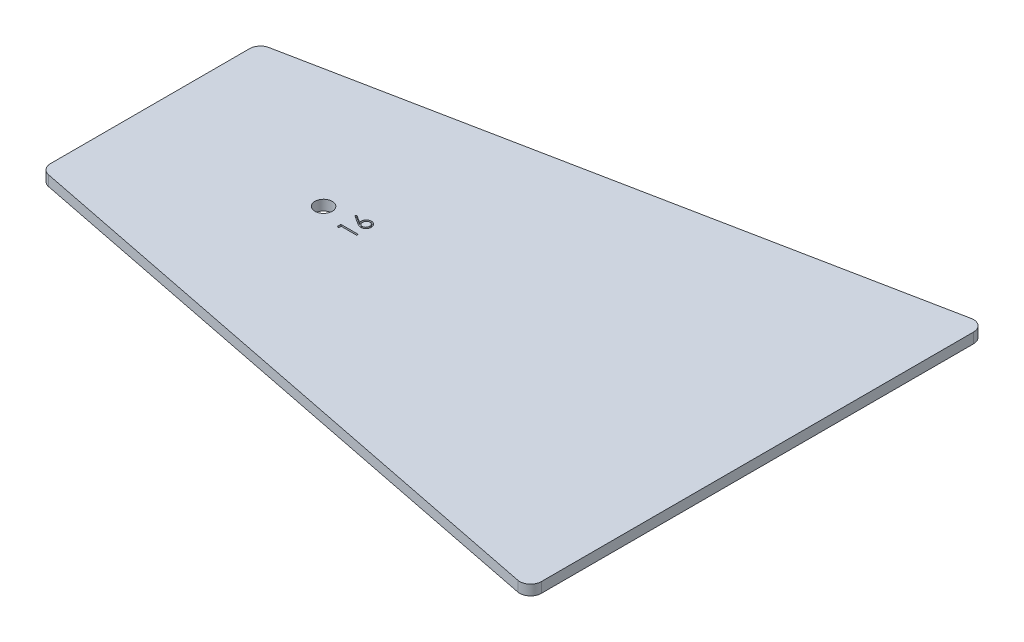
from build123d import *

# Parameters (mm, degrees)
BOSS_EXTRUDE1_DEPTH   = 5.9944
SKETCH2_R             = 5.08
CUT_EXTRUDE1_DEPTH    = 381.139257342
CUT_EXTRUDE2_DEPTH    = 1.27
FILLET1_R             = 6.35
BODY_MOVE_COPY1_ANGLE = 90


with BuildPart() as part:
    # Sketch1 → Boss-Extrude1 (new body)
    with BuildSketch(Plane(origin=(0, 0, 0), x_dir=(1, 0, 0), z_dir=(0, 1, 0))):
        Polygon((-63.5, 0), (63.5, 0), (134.23323784, -355.6), (-134.23323784, -355.6), align=None)
    extrude(amount=BOSS_EXTRUDE1_DEPTH)

    # Sketch2 → Cut-Extrude1 (cut, through all)
    with BuildSketch(Plane(origin=(0, 5.9944, 0), x_dir=(1, 0, 0), z_dir=(0, 1, 0))):
        with Locations(Location((0, -101.6, 0), (0, 0, 270))):
            Circle(SKETCH2_R)
    extrude(amount=-CUT_EXTRUDE1_DEPTH, mode=Mode.SUBTRACT)

    # Sketch3 → Cut-Extrude2 (cut)
    # profile 1 of 2: a face of its own
    with BuildSketch(Plane(origin=(0, 5.9944, 0), x_dir=(1, 0, 0), z_dir=(0, 1, 0))):
        Polygon((-5.958315024, -115.820937251), (-4.079773357, -115.820937251), (-4.079773357, -125.980937251), (-4.991568229, -125.980937251), (-4.991568229, -116.862988533), (-6.554645152, -116.862988533), align=None)
    # profile 2 of 2: a face of its own
    with BuildSketch(Plane(origin=(0, 5.9944, 0), x_dir=(1, 0, 0), z_dir=(0, 1, 0))):
        with BuildLine():
            Line((4.386893309, -115.56042443), (5.089056771, -116.111978917))
            Line((5.089056771, -116.111978917), (2.404553566, -120.217091097))
            add(Edge.make_bspline(
                [(2.404553566, -120.217091097), (2.583283284, -120.188602861), (2.931915808, -120.133033337), (3.284804245, -120.123866273), (3.45678113, -120.119398789)],
                knots=[0, 0, 0, 0, 1.025318673, 2, 2, 2, 2], degree=3))
            add(Edge.make_bspline(
                [(3.45678113, -120.119398789), (3.560043005, -120.122174245), (3.763310933, -120.127637647), (4.061744393, -120.169682196), (4.348514562, -120.235940235), (4.622432842, -120.332524841), (4.884482412, -120.455903104), (5.136167082, -120.603771368), (5.372755774, -120.783765), (5.597295197, -120.984831271), (5.801154428, -121.207529718), (5.981642635, -121.44382617), (6.133249551, -121.693474441), (6.256254992, -121.956348086), (6.351773154, -122.232041891), (6.42140586, -122.520203119), (6.462567193, -122.821030476), (6.468156617, -123.025618551), (6.470995873, -123.12954302)],
                knots=[0, 0, 0, 0, 1.04369286, 2.054478336, 3.041073146, 4.015093852, 4.984733326, 5.965804835, 6.960378782, 7.985147595, 9.009457201, 10.008161701, 10.986880575, 11.956520048, 12.937015923, 13.931873656, 14.949455224, 16, 16, 16, 16], degree=3))
            add(Edge.make_bspline(
                [(6.470995873, -123.12954302), (6.466864803, -123.271724103), (6.458735835, -123.551502827), (6.377735101, -123.958996352), (6.251868247, -124.34720274), (6.071956336, -124.709923946), (5.848487475, -125.046662834), (5.575974235, -125.345034357), (5.264081137, -125.611139379), (4.911422318, -125.833662594), (4.53189417, -126.015390308), (4.133180944, -126.145917982), (3.719154713, -126.226279139), (3.438144765, -126.236353802), (3.295995873, -126.241450071)],
                knots=[0, 0, 0, 0, 1.031375318, 2.029502543, 3.004789286, 3.987476834, 4.960371455, 5.9300674, 6.912260825, 7.929083631, 8.949397511, 9.960523116, 10.96833055, 12, 12, 12, 12], degree=3))
            add(Edge.make_bspline(
                [(3.295995873, -126.241450071), (3.15928088, -126.237013908), (2.888472414, -126.228226646), (2.490105217, -126.149948381), (2.107325715, -126.023072905), (1.742815741, -125.848279457), (1.405153618, -125.627494288), (1.103065942, -125.361702072), (0.838058963, -125.056584311), (0.617515491, -124.712188331), (0.442593001, -124.342103197), (0.311413104, -123.956205623), (0.234788581, -123.555901676), (0.224081227, -123.284539284), (0.218688181, -123.147860328)],
                knots=[0, 0, 0, 0, 1.012016664, 2.004627821, 2.994792927, 3.992885782, 4.990978636, 5.973936114, 6.964471063, 7.975201453, 8.993600317, 9.990122807, 10.98767138, 12, 12, 12, 12], degree=3))
            add(Edge.make_bspline(
                [(0.218688181, -123.147860328), (0.222117747, -123.043228052), (0.229120266, -122.829588936), (0.278014222, -122.506024787), (0.356579455, -122.174950789), (0.44456577, -121.894087187), (0.537531541, -121.664002312), (0.614900056, -121.478499608), (0.711199427, -121.287604607), (0.813883299, -121.084771424), (0.932194667, -120.875227425), (1.060836667, -120.655470487), (1.203365939, -120.428995588), (1.303282754, -120.275306153), (1.354361258, -120.196738533)],
                knots=[0, 0, 0, 0, 1.173818275, 2.396712641, 3.66331629, 4.989737886, 5.693666774, 6.447286557, 7.243889047, 8.091586357, 8.998013824, 9.943181721, 10.948533338, 12, 12, 12, 12], degree=3))
            Line((1.354361258, -120.196738533), (4.386893309, -115.56042443))
        make_face()
        with BuildLine():
            add(Edge.make_bspline(
                [(3.265467027, -121.161450071), (3.188070339, -121.163708621), (3.036892125, -121.168120225), (2.815092315, -121.19373867), (2.605177277, -121.241981443), (2.40436594, -121.303424281), (2.216412608, -121.387906306), (2.03995129, -121.490527528), (1.874299597, -121.611347862), (1.721192601, -121.74865565), (1.58237895, -121.898988912), (1.46283601, -122.06000901), (1.359719557, -122.227835383), (1.275879763, -122.403870278), (1.210594286, -122.588046402), (1.163369878, -122.77951668), (1.137088131, -122.979565066), (1.132715756, -123.115222846), (1.130483053, -123.184494943)],
                knots=[0, 0, 0, 0, 1.129588631, 2.206414736, 3.251139165, 4.268635594, 5.265702196, 6.250456724, 7.242448911, 8.251968645, 9.246821453, 10.222880186, 11.173611482, 12.116736599, 13.062300278, 14.020270554, 14.989073742, 16, 16, 16, 16], degree=3))
            add(Edge.make_bspline(
                [(1.130483053, -123.184494943), (1.132301291, -123.253147456), (1.135866585, -123.387764814), (1.168240176, -123.586143689), (1.217690586, -123.777049823), (1.291250136, -123.959499036), (1.378994474, -124.136272348), (1.494833929, -124.300966776), (1.623188942, -124.463585037), (1.77661636, -124.611635023), (1.941276179, -124.749394823), (2.117192813, -124.869806073), (2.300537154, -124.972817365), (2.493784482, -125.053549009), (2.694193048, -125.119804653), (2.903432599, -125.166428832), (3.121648659, -125.192788302), (3.269467771, -125.197166373), (3.344842027, -125.199398789)],
                knots=[0, 0, 0, 0, 0.989467248, 1.94019797, 2.891935182, 3.827694429, 4.772920941, 5.730924762, 6.725747692, 7.756678648, 8.79901574, 9.819492441, 10.826891316, 11.826466727, 12.835195252, 13.867842842, 14.912794438, 16, 16, 16, 16], degree=3))
            add(Edge.make_bspline(
                [(3.344842027, -125.199398789), (3.42021616, -125.197166198), (3.568035029, -125.192787784), (3.786252845, -125.166430802), (3.995485908, -125.119797424), (4.195918058, -125.053575211), (4.389078327, -124.972720162), (4.572262318, -124.870446932), (4.746515298, -124.748654316), (4.91128321, -124.611870444), (5.064072014, -124.462742394), (5.195505486, -124.3024184), (5.307797386, -124.134941263), (5.399046341, -123.960195389), (5.471795689, -123.776939505), (5.521496863, -123.586173243), (5.553803599, -123.387757076), (5.557378079, -123.253144843), (5.559201002, -123.184494943)],
                knots=[0, 0, 0, 0, 1.087397944, 2.132534446, 3.165364764, 4.174271784, 5.174024072, 6.181601208, 7.194203697, 8.236725232, 9.267838612, 10.269026844, 11.221737037, 12.171628256, 13.107553087, 14.05945871, 15.010357665, 16, 16, 16, 16], degree=3))
            add(Edge.make_bspline(
                [(5.559201002, -123.184494943), (5.55760358, -123.115132475), (5.55446836, -122.978996509), (5.519007206, -122.779606166), (5.469825915, -122.587073567), (5.395562032, -122.402608755), (5.299081091, -122.226939663), (5.181563543, -122.059178902), (5.045615282, -121.898040294), (4.888577853, -121.748360827), (4.717627917, -121.611499595), (4.535863817, -121.490683969), (4.345703528, -121.388721179), (4.147339855, -121.303646848), (3.938499944, -121.242252946), (3.722555417, -121.19391096), (3.496744358, -121.168185789), (3.343541404, -121.163723908), (3.265467027, -121.161450071)],
                knots=[0, 0, 0, 0, 0.978206639, 1.919901502, 2.851605144, 3.780102724, 4.718870031, 5.675451981, 6.667674623, 7.690630536, 8.733308323, 9.756129687, 10.767539656, 11.776269907, 12.797430371, 13.836405707, 14.897401972, 16, 16, 16, 16], degree=3))
        make_face(mode=Mode.SUBTRACT)
    extrude(amount=-CUT_EXTRUDE2_DEPTH, mode=Mode.SUBTRACT)

    # Fillet1
    fillet1_edges = [part.edges().sort_by_distance(p)[0] for p in [
        (134.23323784, 2.9972, 355.6),
        (-134.23323784, 2.9972, 355.6),
        (-63.5, 2.9972, 0),
        (63.5, 2.9972, 0),
    ]]
    fillet(fillet1_edges, radius=FILLET1_R)


with BuildPart() as part_1:
    # Body-Move/Copy1: moved
    add(part.part.rotate(Axis((0, 0, 177.8), (0, 1, 0)), BODY_MOVE_COPY1_ANGLE))


solid = part_1.part
